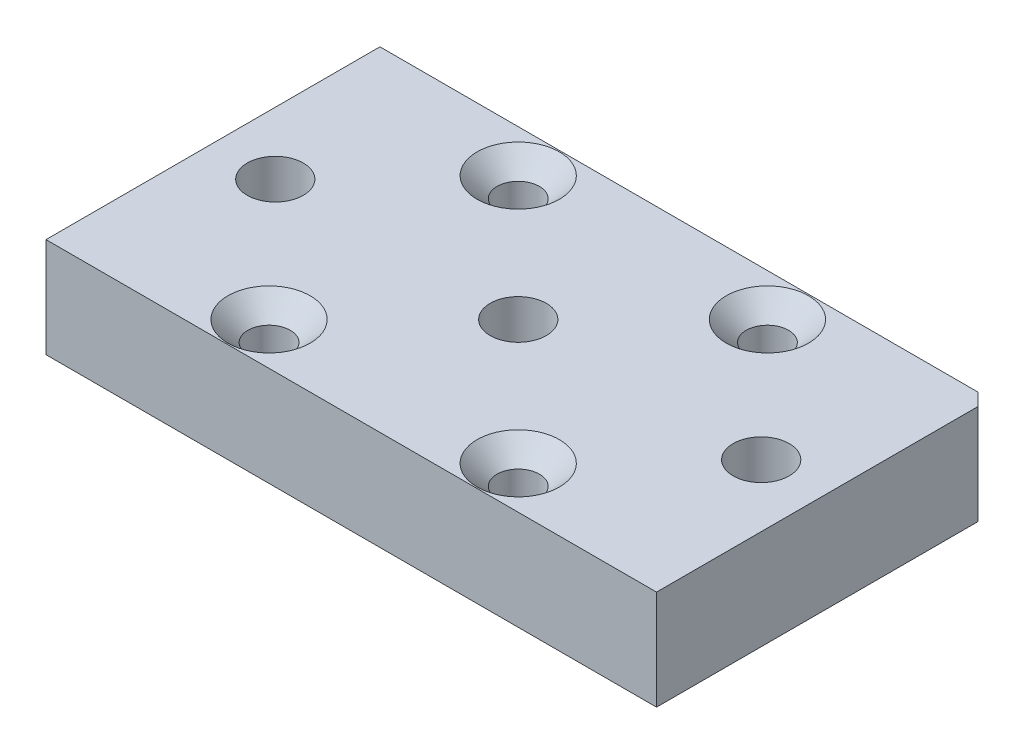
from build123d import *

# Parameters (mm, degrees)
SKETCH_1_W                   = 49
SKETCH_1_H                   = 26.8
EXTRUDE_1_DEPTH              = 8
HOLE_WIZARD_M3_1_D           = 3.4
HOLE_WIZARD_M3_1_CSINK_D     = 6.6
HOLE_WIZARD_M3_1_CSINK_ANGLE = 90
HOLE_WIZARD_M4_1_D           = 4.5
HOLE_WIZARD_M4_1_CSINK_D     = 8.6
HOLE_WIZARD_M4_1_CSINK_ANGLE = 90
CHAMFER_1_SIZE               = 1


with BuildPart() as part:
    # 草图1 → 凸台-拉伸1 (new body)
    with BuildSketch(Plane(origin=(0, 0, 0), x_dir=(1, 0, 0), z_dir=(0, 1, 0))):
        Rectangle(SKETCH_1_W, SKETCH_1_H)
    extrude(amount=EXTRUDE_1_DEPTH)

    # M3 十字槽沉头木螺钉的锥形沉头孔1 (through all)
    with Locations(Plane(origin=(0, 8, 0), x_dir=(1, 0, 0), z_dir=(0, 1, 0))):
        with Locations((-10, -10), (10, -10), (10, 10), (-10, 10)):
            CounterSinkHole(HOLE_WIZARD_M3_1_D / 2, HOLE_WIZARD_M3_1_CSINK_D / 2, counter_sink_angle=HOLE_WIZARD_M3_1_CSINK_ANGLE)

    # M4 十字槽沉头木螺钉的锥形沉头孔1 (through all)
    with Locations(Plane(origin=(0, 0, 0), x_dir=(-1, 0, 0), z_dir=(0, -1, 0))):
        with Locations((19.5, 0), (0, 0), (-19.5, 0)):
            CounterSinkHole(HOLE_WIZARD_M4_1_D / 2, HOLE_WIZARD_M4_1_CSINK_D / 2, counter_sink_angle=HOLE_WIZARD_M4_1_CSINK_ANGLE)

    # 倒角1
    chamfer_1_edges = [part.edges().sort_by_distance(p)[0] for p in [
        (24.5, 4, -13.4),
    ]]
    chamfer(chamfer_1_edges, length=CHAMFER_1_SIZE)


solid = part.part
